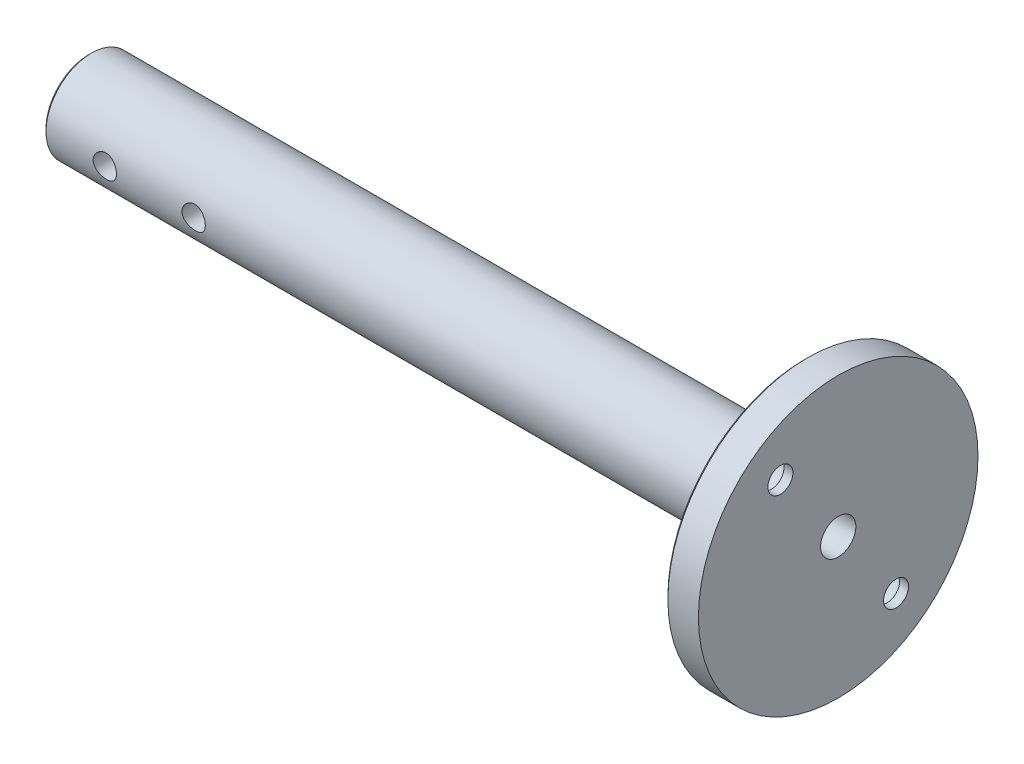
from build123d import *

# Parameters (mm, degrees)
CHANFREIN1_SIZE                                    = 0.5
CHAMBRAGE_POUR_VIS_T_TE_HEXAGONALE_M41_D           = 4.5
CHAMBRAGE_POUR_VIS_T_TE_HEXAGONALE_M41_CBORE_D     = 8
CHAMBRAGE_POUR_VIS_T_TE_HEXAGONALE_M41_CBORE_DEPTH = 4.4
TROU_TARAUD_M51_D                                  = 4.2
TROU_TARAUD_M51_DEPTH                              = 14
TROU_TARAUD_M51_TIP                                = 1.2618073
TROU_TARAUD_M51_ON_FACE_2_D                        = 4.2
TROU_TARAUD_M51_ON_FACE_2_DEPTH                    = 14
TROU_TARAUD_M51_ON_FACE_2_TIP                      = 1.2618073


with BuildPart() as part:
    # Esquisse1 → Révolution1 (revolve)
    with BuildSketch(Plane.XY, mode=Mode.PRIVATE) as r_volution1_sk:
        Polygon((0, 8.175), (129, 8.175), (129, 25.175), (135, 25.175), (135, 3.175), (0, 3.175), align=None)
    revolve(r_volution1_sk.sketch.rotate(Axis((0, 0, 0), (1, 0, 0)), 90), axis=Axis((0, 0, 0), (1, 0, 0)))

    # Chanfrein1
    chanfrein1_edges = [part.edges().sort_by_distance(p)[0] for p in [
        (129, 0, -25.175),
        (0, 0, -8.175),
    ]]
    chamfer(chanfrein1_edges, length=CHANFREIN1_SIZE)

    # Chambrage pour vis à tête hexagonale M41 (through all)
    with Locations(Plane.ZY.offset(-129)):
        with Locations((-10.409398768, -14.067495061), (10.409398768, 14.067495061)):
            CounterBoreHole(CHAMBRAGE_POUR_VIS_T_TE_HEXAGONALE_M41_D / 2, CHAMBRAGE_POUR_VIS_T_TE_HEXAGONALE_M41_CBORE_D / 2, CHAMBRAGE_POUR_VIS_T_TE_HEXAGONALE_M41_CBORE_DEPTH)

    # Trou taraudé M51
    with Locations(Plane(origin=(11.080716358, -0.227251989, 8.171840768), x_dir=(0, 0.999613549573, 0.027798408415), z_dir=(0, -0.027798408415, 0.999613549573))):
        with Locations((0, 0)):
            Hole(TROU_TARAUD_M51_D / 2, depth=TROU_TARAUD_M51_DEPTH)
            with Locations((0, 0, -(TROU_TARAUD_M51_DEPTH + TROU_TARAUD_M51_TIP / 2))):  # 118° drill point
                Cone(0, TROU_TARAUD_M51_D / 2, TROU_TARAUD_M51_TIP, mode=Mode.SUBTRACT)

    # Trou taraudé M51 on face 2
    with Locations(Plane(origin=(27.080716358, -0.227251989, 8.171840768), x_dir=(0, 0.99961356127, 0.027797987799), z_dir=(0, -0.027797987799, 0.99961356127))):
        with Locations((0, 0)):
            Hole(TROU_TARAUD_M51_ON_FACE_2_D / 2, depth=TROU_TARAUD_M51_ON_FACE_2_DEPTH)
            with Locations((0, 0, -(TROU_TARAUD_M51_ON_FACE_2_DEPTH + TROU_TARAUD_M51_ON_FACE_2_TIP / 2))):  # 118° drill point
                Cone(0, TROU_TARAUD_M51_ON_FACE_2_D / 2, TROU_TARAUD_M51_ON_FACE_2_TIP, mode=Mode.SUBTRACT)


solid = part.part
